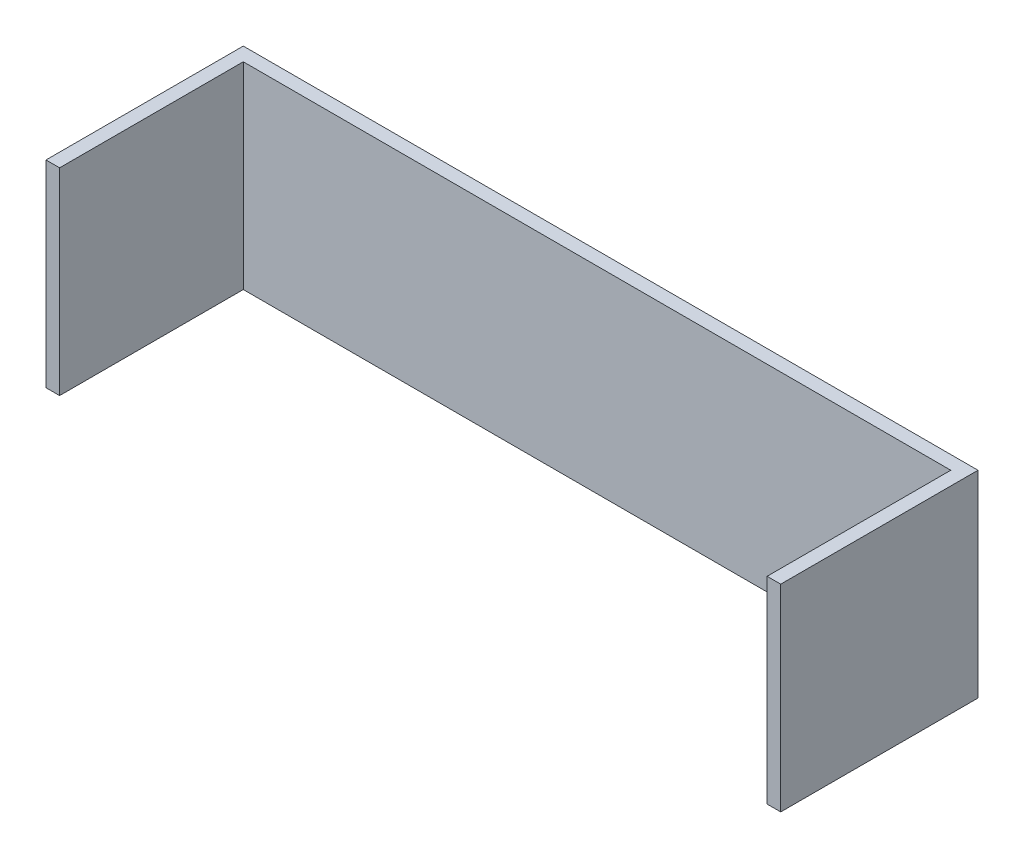
from build123d import *

# Parameters (mm, degrees)
BOSS_EXTRUDE1_DEPTH = 145


with BuildPart() as part:
    # Sketch1 → Boss-Extrude1 (new body)
    with BuildSketch(Plane(origin=(0, 0, 0), x_dir=(1, 0, 0), z_dir=(0, 1, 0))):
        Polygon((0, 0), (-540, 0), (-540, -145), (-530, -145), (-530, -10), (-10, -10), (-10, -145), (0, -145), align=None)
    extrude(amount=BOSS_EXTRUDE1_DEPTH)


solid = part.part
